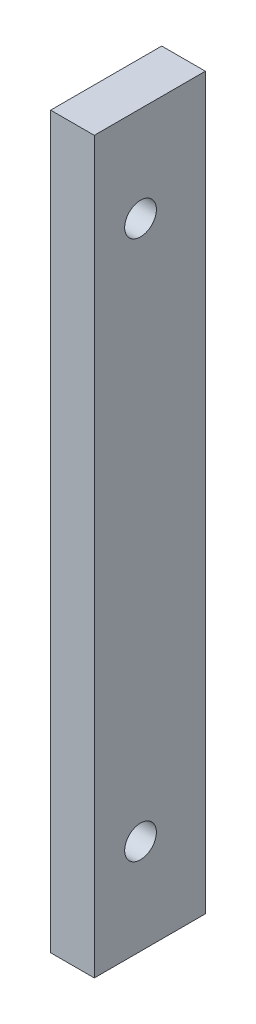
from build123d import *

# Parameters (mm, degrees)
SKETCH1_W           = 38.1
SKETCH1_H           = 88.9
BOSS_EXTRUDE1_DEPTH = 584.2
SKETCH2_R           = 12.7
CUT_EXTRUDE1_DEPTH  = 593.152395925
SKETCH2_3_W         = 88.9
SKETCH2_3_H         = 584.2
SKETCH2_3_R         = 12.7
CUT_EXTRUDE2_DEPTH  = 3.175


with BuildPart() as part:
    # Sketch1 → Boss-Extrude1 (new body)
    with BuildSketch(Plane(origin=(0, 0, 0), x_dir=(1, 0, 0), z_dir=(0, 1, 0))):
        with Locations((19.05, 44.45)):
            Rectangle(SKETCH1_W, SKETCH1_H)
    extrude(amount=BOSS_EXTRUDE1_DEPTH)

    # Sketch2 → Cut-Extrude1 (cut, through all)
    with BuildSketch(Plane(origin=(38.1, 0, 0), x_dir=(0, 0, -1), z_dir=(1, 0, 0))):
        with Locations((37.01034, 76.2)):
            Circle(SKETCH2_R)
        with Locations((37.01034, 508)):
            Circle(SKETCH2_R)
    extrude(amount=-CUT_EXTRUDE1_DEPTH, mode=Mode.SUBTRACT)

    # Sketch2<3> → Cut-Extrude2 (cut)
    with BuildSketch(Plane(origin=(38.1, 0, 0), x_dir=(0, 0, -1), z_dir=(1, 0, 0))):
        with Locations((44.45, 292.1)):
            Rectangle(SKETCH2_3_W, SKETCH2_3_H)
        with Locations((37.01034, 76.2)):
            Circle(SKETCH2_3_R, mode=Mode.SUBTRACT)
        with Locations((37.01034, 508)):
            Circle(SKETCH2_3_R, mode=Mode.SUBTRACT)
    extrude(amount=-CUT_EXTRUDE2_DEPTH, mode=Mode.SUBTRACT)


solid = part.part
